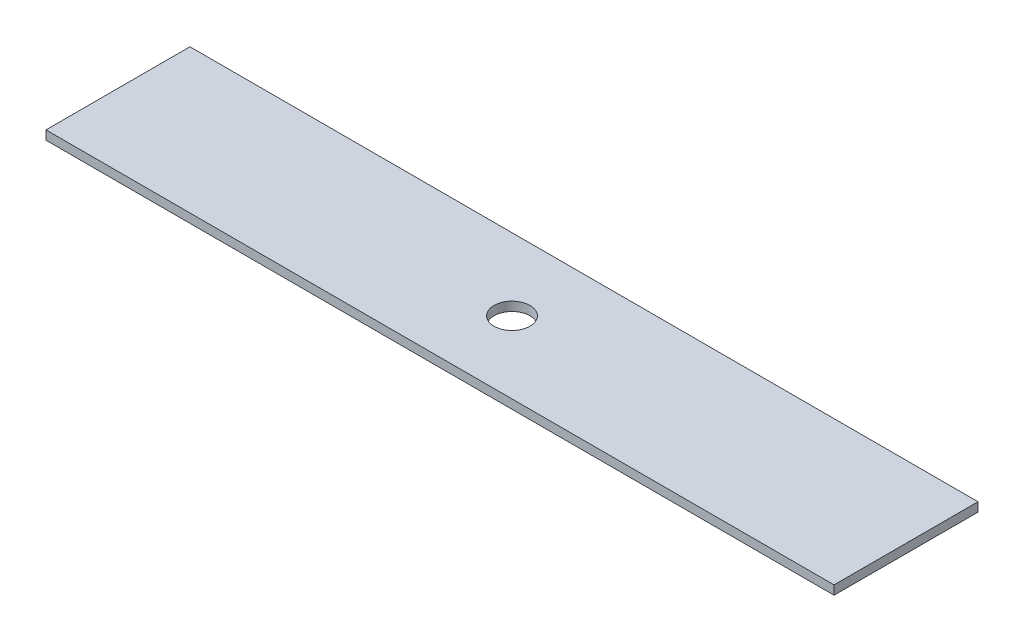
from build123d import *

# Parameters (mm, degrees)
SKETCH1_W           = 278.13
SKETCH1_H           = 50.8
BOSS_EXTRUDE1_DEPTH = 3.175
SKETCH2_R           = 6.35
CUT_EXTRUDE1_DEPTH  = 142.401254768


with BuildPart() as part:
    # Sketch1 → Boss-Extrude1 (new body)
    with BuildSketch(Plane(origin=(0, 0, 0), x_dir=(1, 0, 0), z_dir=(0, 1, 0))):
        Rectangle(SKETCH1_W, SKETCH1_H)
    extrude(amount=BOSS_EXTRUDE1_DEPTH)

    # Sketch2 → Cut-Extrude1 (cut, through all)
    with BuildSketch(Plane(origin=(0, 3.175, 0), x_dir=(1, 0, 0), z_dir=(0, 1, 0))):
        with Locations(Location((0, 0, 0), (0, 0, 270))):
            Circle(SKETCH2_R)
    extrude(amount=-CUT_EXTRUDE1_DEPTH, mode=Mode.SUBTRACT)


solid = part.part
